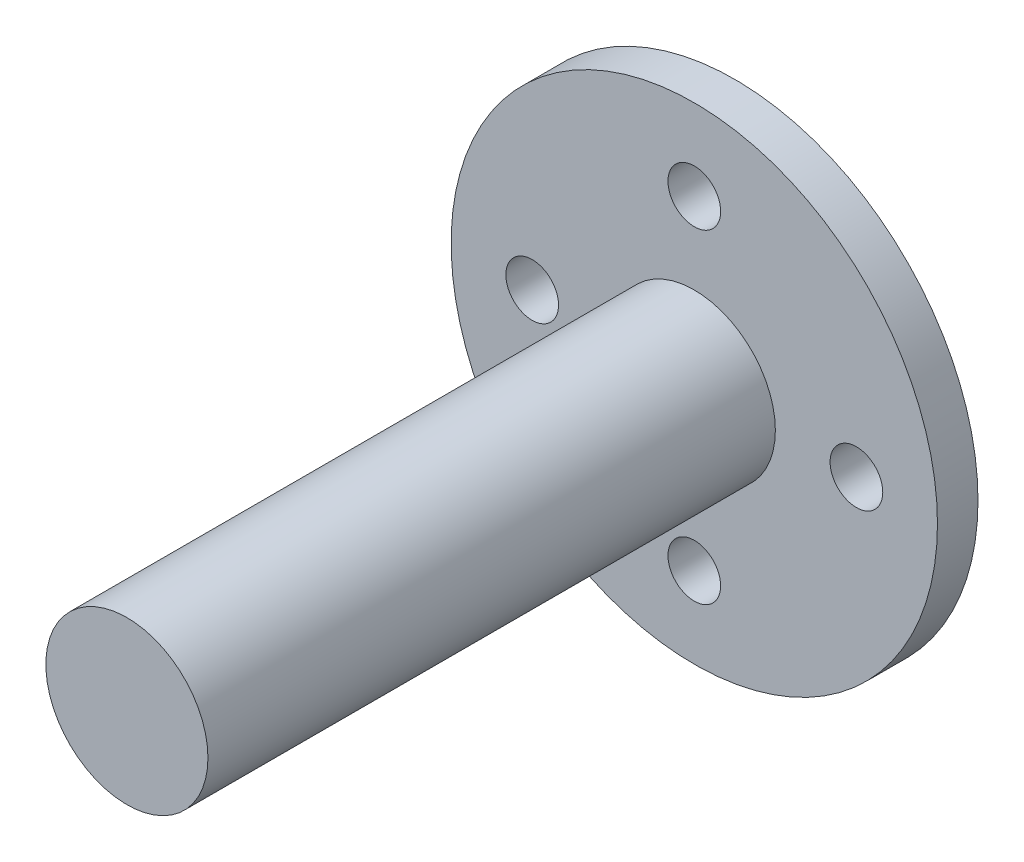
from build123d import *

# Parameters (mm, degrees)
HUB_FLANGE_PROFILE_R   = 30
HUB_FLANGE_PROFILE_R_2 = 3.25
HUB_FLANGE_5MM_DEPTH   = 5
STUB_AXLE_PROFILE_R    = 10
STUB_AXLE_75MM_DEPTH   = 75


with BuildPart() as part:
    # Hub_Flange_Profile → Hub_Flange_5mm (new body)
    with BuildSketch(Plane.XY):
        Circle(HUB_FLANGE_PROFILE_R)
        with Locations((20, 0)):
            Circle(HUB_FLANGE_PROFILE_R_2, mode=Mode.SUBTRACT)
        with Locations((0, 20)):
            Circle(HUB_FLANGE_PROFILE_R_2, mode=Mode.SUBTRACT)
        with Locations((-20, 0)):
            Circle(HUB_FLANGE_PROFILE_R_2, mode=Mode.SUBTRACT)
        with Locations((0, -20)):
            Circle(HUB_FLANGE_PROFILE_R_2, mode=Mode.SUBTRACT)
    extrude(amount=HUB_FLANGE_5MM_DEPTH)

    # Stub_Axle_Profile → Stub_Axle_75mm (add)
    with BuildSketch(Plane.XY):
        Circle(STUB_AXLE_PROFILE_R)
    extrude(amount=STUB_AXLE_75MM_DEPTH)


solid = part.part
